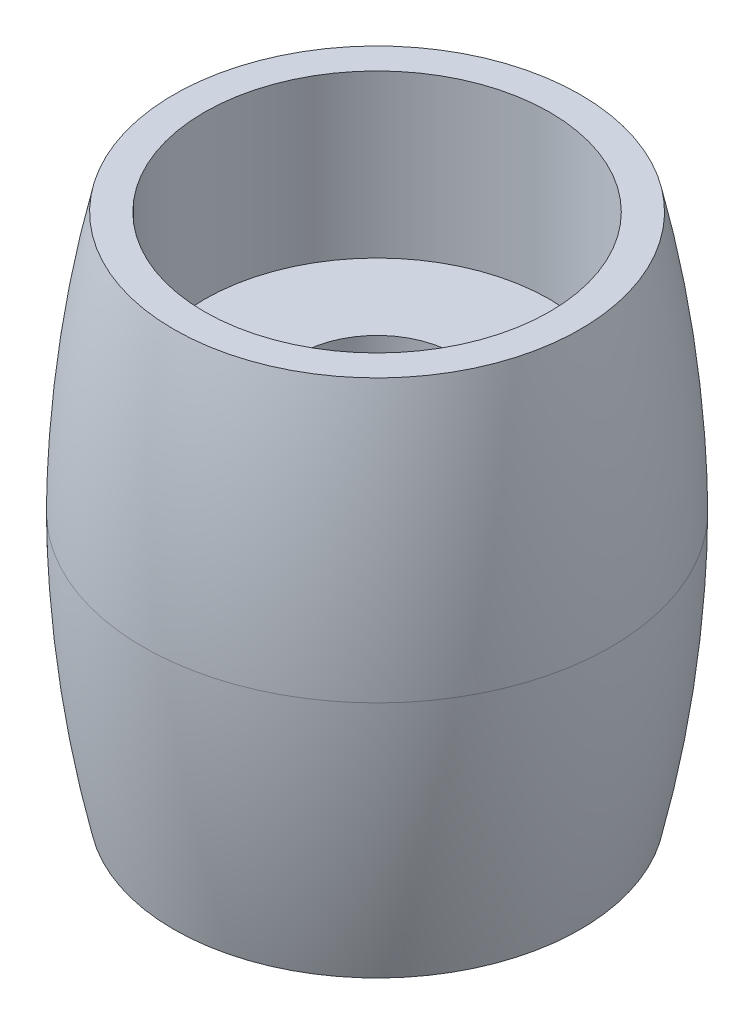
from build123d import *


with BuildPart() as part:
    # Sketch1 → Revolve1 (revolve)
    with BuildSketch(Plane.XY, mode=Mode.PRIVATE) as revolve1_sk:
        with BuildLine():
            Line((5.65, -3.2), (2.55, -3.2))
            Line((2.55, -3.2), (2.55, 0))
            Line((2.55, 0), (7.65, 0))
            ThreePointArc((7.65, 0), (7.37799262, -4.276822661), (6.65, -8.5))
            Line((6.65, -8.5), (5.65, -8.5))
            Line((5.65, -8.5), (5.65, -3.2))
        make_face()
    revolve1 = revolve(revolve1_sk.sketch.rotate(Axis((0, -14.57105974, 0), (0, 1, 0)), 90), axis=Axis((0, -14.57105974, 0), (0, 1, 0)))

    # Mirror1: Revolve1 across plane
    add(revolve1.mirror(Plane(origin=(2.55, 0, 0), x_dir=(0, 0, 1), z_dir=(0, 1, 0))))


solid = part.part
